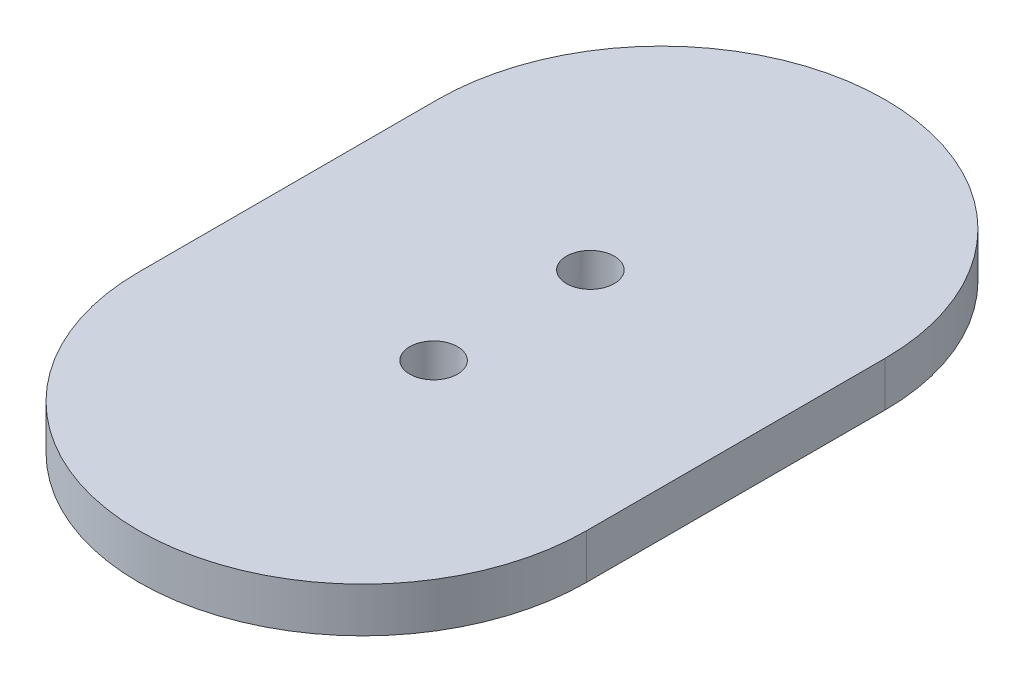
from build123d import *

# Parameters (mm, degrees)
EXTRUDE_1_DEPTH     = 3
SKETCH_2_R          = 1.6
CUT_EXTRUDE_1_DEPTH = 3


with BuildPart() as part:
    # 草图1 → 凸台-拉伸1 (new body)
    with BuildSketch(Plane(origin=(0, 0, 0), x_dir=(1, 0, 0), z_dir=(0, 1, 0))):
        with BuildLine():
            Line((-15, 0), (-15, -20))
            ThreePointArc((-15, -20), (0, -35), (15, -20))
            Line((15, -20), (15, 0))
            ThreePointArc((15, 0), (0, 15), (-15, 0))
        make_face()
    extrude(amount=EXTRUDE_1_DEPTH)

    # 草图2 → 切除-拉伸1 (cut)
    with BuildSketch(Plane(origin=(0, 3, 0), x_dir=(1, 0, 0), z_dir=(0, 1, 0))):
        with Locations(Location((0, -4.75, 0), (0, 0, 270))):
            Circle(SKETCH_2_R)
        with Locations(Location((0, -15.25, 0), (0, 0, 270))):
            Circle(SKETCH_2_R)
    extrude(amount=-CUT_EXTRUDE_1_DEPTH, mode=Mode.SUBTRACT)


solid = part.part
